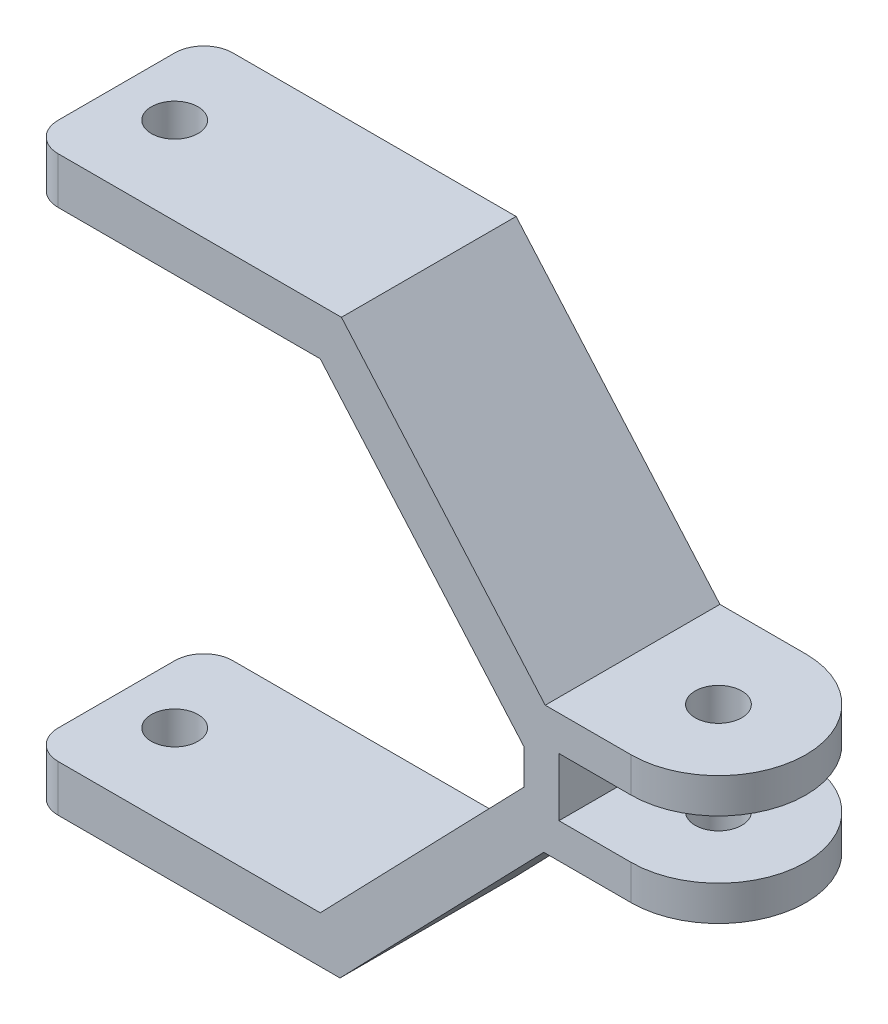
from build123d import *

# Parameters (mm, degrees)
EXTRUDE_1_DEPTH     = 15
CUT_EXTRUDE_1_REACH = 74.926
SKETCH_2_R          = 2
SKETCH_3_R          = 7.5
EXTRUDE_2_DEPTH     = 3
EXTRUDE_START       = -3
SKETCH_4_R          = 7.5
EXTRUDE_3_DEPTH     = 3
SKETCH_5_R          = 2
CUT_EXTRUDE_2_DEPTH = 11
FILLET_1_R          = 2.5


with BuildPart() as part:
    # 草圖1 → 填料-伸長1 (new body)
    with BuildSketch(Plane.XY):
        Polygon((-26.696480976, 45.2), (-47.696480976, 45.2), (-51.696480976, 45.2), (-51.696480976, 49.2), (-24.875445442, 49.2), (-7.375445442, 29.1), (0, 29.1), (0, 26.1), (-6.196480976, 26.1), (-6.196480976, 21.1), (0, 21.1), (0, 18.1), (-7.5, 18.1), (-25, 0), (-51.696480976, 0), (-51.696480976, 4), (-47.696480976, 4), (-26.696480976, 4), (-9.196480976, 22.1), (-9.196480976, 25.1), align=None)
    extrude(amount=EXTRUDE_1_DEPTH)

    # 除料-伸長1: up to this face of the body (flat: up to its plane)
    cut_extrude_1_end = Plane(part.part.faces().sort_by_distance((-38.285963209, 49.2, 7.5))[0])
    # 草圖2 → 除料-伸長1 (cut, up to the picked face)
    with BuildSketch(Plane.XZ, mode=Mode.PRIVATE) as cut_extrude_1_sk1:
        with Locations((-46.696480976, 7.5)):
            Circle(SKETCH_2_R)
    cut_extrude_1_tool1 = split(extrude(cut_extrude_1_sk1.sketch, amount=-CUT_EXTRUDE_1_REACH, mode=Mode.PRIVATE), bisect_by=cut_extrude_1_end, keep=Keep.BOTH, mode=Mode.PRIVATE)
    add(cut_extrude_1_tool1.solids().sort_by(Axis((-46.696481, 0, 7.5), (0, 1, 0)))[0], mode=Mode.SUBTRACT)

    # 草圖3 → 填料-伸長2 (add)
    with BuildSketch(Plane.XZ.offset(-18.1)):
        with Locations((0, 7.5)):
            Circle(SKETCH_3_R)
    extrude(amount=-EXTRUDE_2_DEPTH)

    # 草圖4 → 填料-伸長3 (add)
    with BuildSketch(Plane(origin=(0, 29.1, 0), x_dir=(1, 0, 0), z_dir=(0, 1, 0)).offset(EXTRUDE_START)):
        with Locations((0, -7.5)):
            Circle(SKETCH_4_R)
    extrude(amount=EXTRUDE_3_DEPTH)

    # 草圖5 → 除料-伸長2 (cut)
    with BuildSketch(Plane(origin=(0, 29.1, 0), x_dir=(1, 0, 0), z_dir=(0, 1, 0))):
        with Locations(Location((0, -7.5, 0), (0, 0, 270))):
            Circle(SKETCH_5_R)
    extrude(amount=-CUT_EXTRUDE_2_DEPTH, mode=Mode.SUBTRACT)

    # 圓角1
    fillet_1_edges = [part.edges().sort_by_distance(p)[0] for p in [
        (-51.696480976, 47.2, 0),
        (-51.696480976, 2, 15),
        (-51.696480976, 2, 0),
        (-51.696480976, 47.2, 15),
    ]]
    fillet(fillet_1_edges, radius=FILLET_1_R)


solid = part.part
